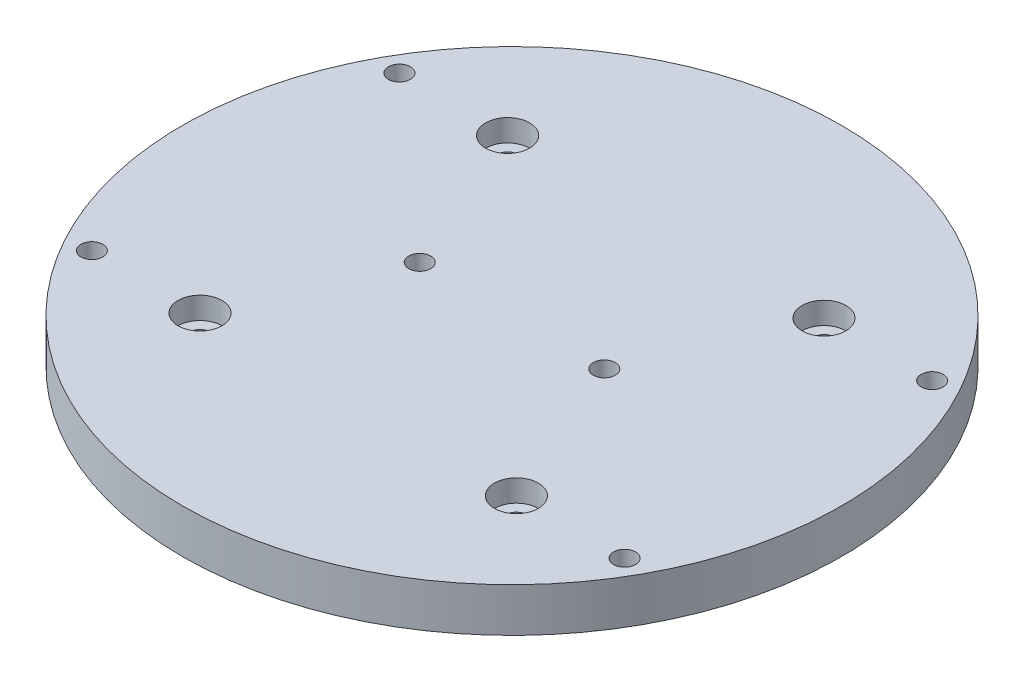
from build123d import *

# Parameters (mm, degrees)
SKETCH_1_R          = 75
EXTRUDE_1_DEPTH     = 10
SKETCH_2_R          = 2.5
CUT_EXTRUDE_1_DEPTH = 27
SKETCH_3_R          = 5
CUT_EXTRUDE_2_DEPTH = 5


with BuildPart() as part:
    # 草图1 → 凸台-拉伸1 (new body)
    with BuildSketch(Plane(origin=(0, 0, 0), x_dir=(1, 0, 0), z_dir=(0, 1, 0))):
        with Locations(Location((0, 0, 0), (0, 0, 270))):
            Circle(SKETCH_1_R)
    extrude(amount=EXTRUDE_1_DEPTH)

    # 草图2 → 切除-拉伸1 (cut)
    with BuildSketch(Plane(origin=(0, 10, 0), x_dir=(1, 0, 0), z_dir=(0, 1, 0))):
        with Locations(Location((21, 0, 0), (0, 0, 270))):
            Circle(SKETCH_2_R)
        with Locations(Location((-21, 0, 0), (0, 0, 270))):
            Circle(SKETCH_2_R)
        with Locations(Location((36, 35, 0), (0, 0, 270))):
            Circle(SKETCH_2_R)
        with Locations(Location((36, -35, 0), (0, 0, 270))):
            Circle(SKETCH_2_R)
        with Locations(Location((-36, -35, 0), (0, 0, 270))):
            Circle(SKETCH_2_R)
        with Locations(Location((-36, 35, 0), (0, 0, 270))):
            Circle(SKETCH_2_R)
        with Locations(Location((60.621778265, 35, 0), (0, 0, 270))):
            Circle(SKETCH_2_R)
        with Locations(Location((60.621778265, -35, 0), (0, 0, 270))):
            Circle(SKETCH_2_R)
        with Locations(Location((-60.621778265, -35, 0), (0, 0, 270))):
            Circle(SKETCH_2_R)
        with Locations(Location((-60.621778265, 35, 0), (0, 0, 270))):
            Circle(SKETCH_2_R)
    extrude(amount=-CUT_EXTRUDE_1_DEPTH, mode=Mode.SUBTRACT)

    # 草图3 → 切除-拉伸2 (cut)
    with BuildSketch(Plane(origin=(0, 10, 0), x_dir=(1, 0, 0), z_dir=(0, 1, 0))):
        with Locations(Location((36, 35, 0), (0, 0, 270))):
            Circle(SKETCH_3_R)
        with Locations(Location((36, -35, 0), (0, 0, 270))):
            Circle(SKETCH_3_R)
        with Locations(Location((-36, -35, 0), (0, 0, 270))):
            Circle(SKETCH_3_R)
        with Locations(Location((-36, 35, 0), (0, 0, 270))):
            Circle(SKETCH_3_R)
    extrude(amount=-CUT_EXTRUDE_2_DEPTH, mode=Mode.SUBTRACT)


solid = part.part
